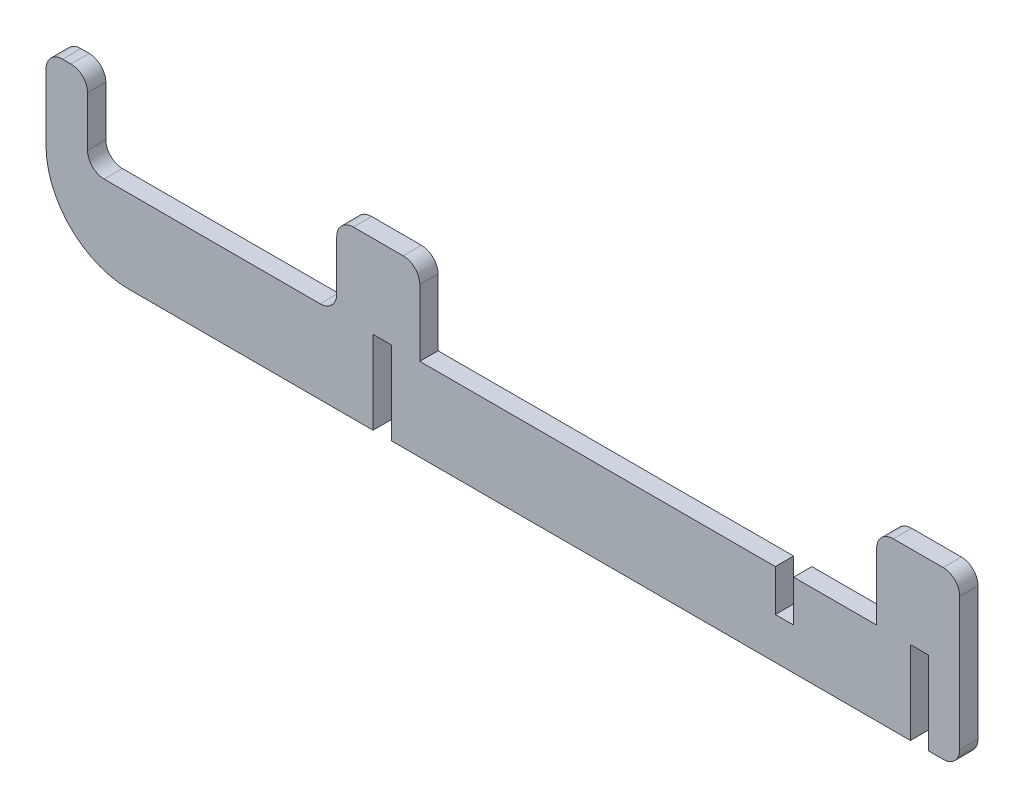
from build123d import *

# Parameters (mm, degrees)
BOSS_EXTRUDE1_DEPTH = 2.794
FILLET1_R           = 2.54
SKETCH2_W           = 2.794
SKETCH2_H           = 12.7
SKETCH2_H_2         = 6.35
CUT_EXTRUDE1_DEPTH  = 99.618096392
FILLET2_R           = 12.7


with BuildPart() as part:
    # Sketch1 → Boss-Extrude1 (new body)
    with BuildSketch(Plane.XY):
        Polygon((0, 0), (95.25, 0), (95.25, 25.4), (82.55, 25.4), (82.55, 12.7), (12.7, 12.7), (12.7, 25.4), (0, 25.4), (0, 12.7), (-38.1, 12.7), (-38.1, 25.4), (-44.45, 25.4), (-44.45, 0), align=None)
    extrude(amount=BOSS_EXTRUDE1_DEPTH)

    # Fillet1
    fillet1_edges = [part.edges().sort_by_distance(p)[0] for p in [
        (-44.45, 25.4, 1.397),
        (-38.1, 25.4, 1.397),
        (-38.1, 12.7, 1.397),
        (0, 12.7, 1.397),
        (0, 25.4, 1.397),
        (12.7, 25.4, 1.397),
        (82.55, 25.4, 1.397),
        (95.25, 25.4, 1.397),
        (95.25, 0, 1.397),
    ]]
    fillet(fillet1_edges, radius=FILLET1_R)

    # Sketch2 → Cut-Extrude1 (cut, through all)
    with BuildSketch(Plane.XY.offset(2.794)):
        with Locations((89.115859958, 6.35)):
            Rectangle(SKETCH2_W, SKETCH2_H)
        with Locations((6.946859958, 6.35)):
            Rectangle(SKETCH2_W, SKETCH2_H)
        with Locations((68.453, 9.525)):
            Rectangle(SKETCH2_W, SKETCH2_H_2)
    extrude(amount=-CUT_EXTRUDE1_DEPTH, mode=Mode.SUBTRACT)

    # Fillet2
    fillet2_edges = [part.edges().sort_by_distance(p)[0] for p in [
        (-44.45, 0, 1.397),
    ]]
    fillet(fillet2_edges, radius=FILLET2_R)


solid = part.part
